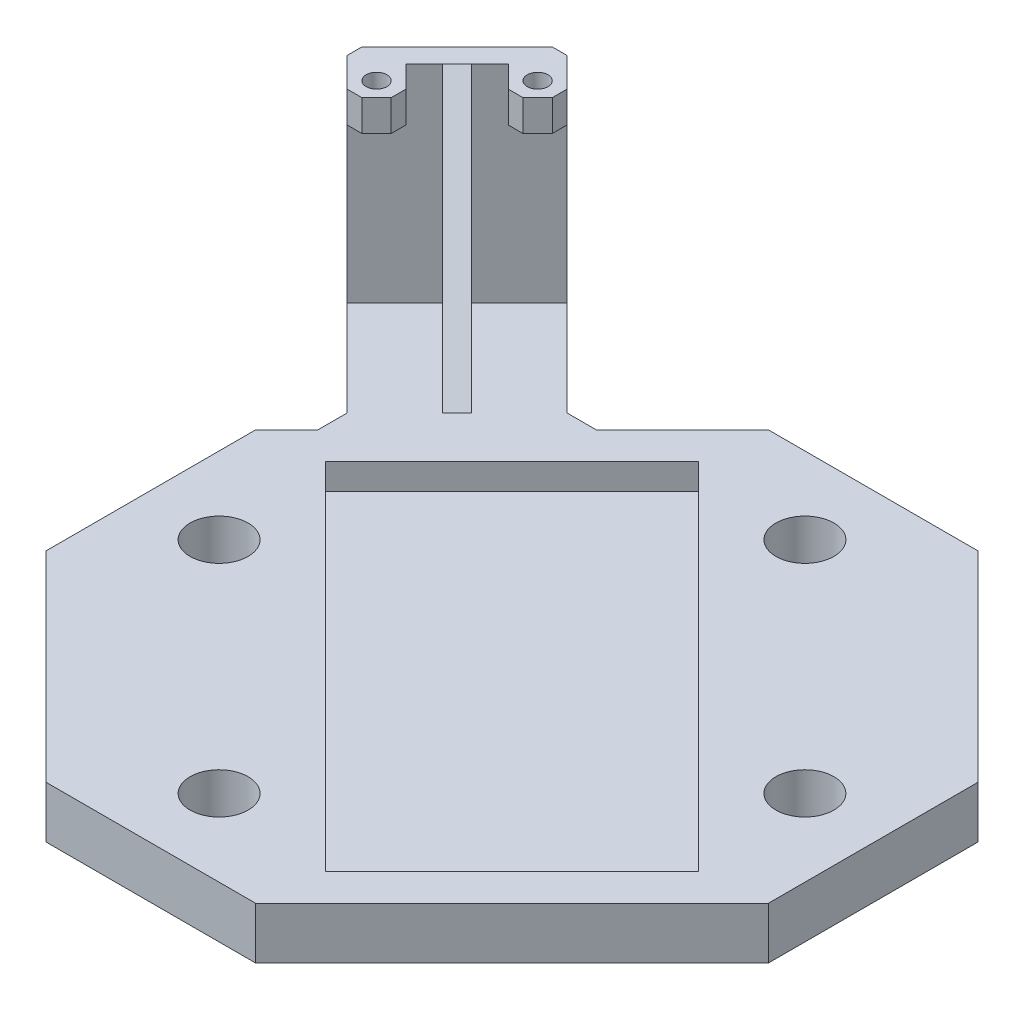
from build123d import *

# Parameters (mm, degrees)
SKETCH1_R           = 2.8
BOSS_EXTRUDE1_DEPTH = 5
CUT_EXTRUDE1_DEPTH  = 2.5
SKETCH3_W           = 35
SKETCH3_H           = 5
BOSS_EXTRUDE2_DEPTH = 17
BOSS_EXTRUDE3_DEPTH = 20
SKETCH5_W           = 4
SKETCH5_H           = 3
BOSS_EXTRUDE4_DEPTH = 4
CUT_EXTRUDE2_REACH  = 80.107
SKETCH6_R           = 1
CUT_EXTRUDE5_REACH  = 93.963
SKETCH12_W          = 6.25
SKETCH12_H          = 20
SKETCH12_W_2        = 13.75
CUT_EXTRUDE6_REACH  = 78.654
CHAMFER6_SIZE       = 2
CHAMFER7_SIZE       = 1
CHAMFER8_SIZE       = 1
RIB1_REACH          = 69.778
SKETCH17_WALL_W     = 161.408820482
SKETCH17_WALL_H     = 2


with BuildPart() as part:
    # Sketch1 → Boss-Extrude1 (new body)
    with BuildSketch(Plane(origin=(0, 0, 0), x_dir=(1, 0, 0), z_dir=(0, 1, 0))):
        Polygon((-40.303943114, 15.555205773), (-15.555205773, 40.303943114), (4.694794227, 40.303943114), (24.042773974, 20.955963368), (24.042773974, 0.705963368), (-0.705963368, -24.042773974), (-20.955963368, -24.042773974), (-40.303943114, -4.694794227), align=None)
        with Locations(Location((-11.666118476, -16.618152771, 0), (0, 0, 270))):
            Circle(SKETCH1_R, mode=Mode.SUBTRACT)
        with Locations(Location((16.618152771, 11.666118476, 0), (0, 0, 270))):
            Circle(SKETCH1_R, mode=Mode.SUBTRACT)
        with Locations(Location((-4.595050664, 32.879321912, 0), (0, 0, 270))):
            Circle(SKETCH1_R, mode=Mode.SUBTRACT)
        with Locations(Location((-32.879321912, 4.595050664, 0), (0, 0, 270))):
            Circle(SKETCH1_R, mode=Mode.SUBTRACT)
    extrude(amount=BOSS_EXTRUDE1_DEPTH)

    # Sketch2 → Cut-Extrude1 (cut)
    with BuildSketch(Plane(origin=(0, 5, 0), x_dir=(1, 0, 0), z_dir=(0, 1, 0))):
        Polygon((0.001143413, -18.032366333), (-34.293535474, 16.262312554), (-16.262312554, 34.293535474), (18.032366333, -0.001143413), align=None)
    extrude(amount=-CUT_EXTRUDE1_DEPTH, mode=Mode.SUBTRACT)

    # Sketch3 → Boss-Extrude2 (add)
    with BuildSketch(Plane(origin=(-27.929574444, 0, -27.929574444), x_dir=(-0.7071067811865489, 0, 0.7071067811865461), z_dir=(-0.7071067811865461, 0, -0.7071067811865489))):
        with Locations((0, 2.5)):
            Rectangle(SKETCH3_W, SKETCH3_H)
    extrude(amount=BOSS_EXTRUDE2_DEPTH)

    # Sketch4 → Boss-Extrude3 (add)
    with BuildSketch(Plane(origin=(0, 5, 0), x_dir=(1, 0, 0), z_dir=(0, 1, 0))):
        Polygon((-52.324758395, 27.576021053), (-50.910544832, 26.161807491), (-26.161807491, 50.910544832), (-27.576021053, 52.324758395), align=None)
    extrude(amount=BOSS_EXTRUDE3_DEPTH)

    # Sketch5 → Boss-Extrude4 (add)
    with BuildSketch(Plane(origin=(-38.536176161, 0, -38.536176161), x_dir=(0.7071067811865475, 0, -0.7071067811865477), z_dir=(0.7071067811865477, 0, 0.7071067811865475))):
        with Locations((-9.25, 23.5)):
            Rectangle(SKETCH5_W, SKETCH5_H)
        with Locations((1.75, 23.5)):
            Rectangle(SKETCH5_W, SKETCH5_H)
    extrude(amount=BOSS_EXTRUDE4_DEPTH)

    # Sketch6 → Cut-Extrude2 (cut, up to next)
    with BuildSketch(Plane(origin=(0, 25, 0), x_dir=(1, 0, 0), z_dir=(0, 1, 0)), mode=Mode.PRIVATE) as cut_extrude2_sk1:
        with Locations(Location((-43.662700325, 30.581224873, 0), (0, 0, 270))):
            Circle(SKETCH6_R)
    cut_extrude2_tool1 = extrude(cut_extrude2_sk1.sketch, amount=-CUT_EXTRUDE2_REACH, mode=Mode.PRIVATE) & part.part
    # Sketch6 → Cut-Extrude2 (cut, up to next)
    with BuildSketch(Plane(origin=(0, 25, 0), x_dir=(1, 0, 0), z_dir=(0, 1, 0)), mode=Mode.PRIVATE) as cut_extrude2_sk2:
        with Locations(Location((-35.884525732, 38.359399466, 0), (0, 0, 270))):
            Circle(SKETCH6_R)
    cut_extrude2_tool2 = extrude(cut_extrude2_sk2.sketch, amount=-CUT_EXTRUDE2_REACH, mode=Mode.PRIVATE) & part.part
    add(cut_extrude2_tool1.solids().sort_by_distance((-43.6627, 25, -30.581225))[0], mode=Mode.SUBTRACT)
    add(cut_extrude2_tool2.solids().sort_by_distance((-35.884526, 25, -38.359399))[0], mode=Mode.SUBTRACT)

    # Sketch12 → Cut-Extrude5 (cut, up to next)
    with BuildSketch(Plane(origin=(-38.536176161, 0, -38.536176161), x_dir=(0.7071067811865476, 0, -0.7071067811865476), z_dir=(0.7071067811865476, 0, 0.7071067811865476)), mode=Mode.PRIVATE) as cut_extrude5_sk1:
        with Locations((-14.375, 15)):
            Rectangle(SKETCH12_W, SKETCH12_H)
    cut_extrude5_tool1 = extrude(cut_extrude5_sk1.sketch, amount=-CUT_EXTRUDE5_REACH, mode=Mode.PRIVATE) & part.part
    # Sketch12 → Cut-Extrude5 (cut, up to next)
    with BuildSketch(Plane(origin=(-38.536176161, 0, -38.536176161), x_dir=(0.7071067811865476, 0, -0.7071067811865476), z_dir=(0.7071067811865476, 0, 0.7071067811865476)), mode=Mode.PRIVATE) as cut_extrude5_sk2:
        with Locations((10.625, 15)):
            Rectangle(SKETCH12_W_2, SKETCH12_H)
    cut_extrude5_tool2 = extrude(cut_extrude5_sk2.sketch, amount=-CUT_EXTRUDE5_REACH, mode=Mode.PRIVATE) & part.part
    add(cut_extrude5_tool1.solids().sort_by_distance((-48.700836, 15, -28.371516))[0], mode=Mode.SUBTRACT)
    add(cut_extrude5_tool2.solids().sort_by_distance((-31.023167, 15, -46.049186))[0], mode=Mode.SUBTRACT)

    # Sketch13 → Cut-Extrude6 (cut, up to next)
    with BuildSketch(Plane(origin=(0, 5, 0), x_dir=(1, 0, 0), z_dir=(0, 1, 0)), mode=Mode.PRIVATE) as cut_extrude6_sk1:
        Polygon((-52.324758395, 27.576021053), (-50.910544832, 26.161807491), (-46.49112745, 30.581224873), (-47.905341012, 31.995438435), align=None)
    cut_extrude6_tool1 = extrude(cut_extrude6_sk1.sketch, amount=-CUT_EXTRUDE6_REACH, mode=Mode.PRIVATE) & part.part
    # Sketch13 → Cut-Extrude6 (cut, up to next)
    with BuildSketch(Plane(origin=(0, 5, 0), x_dir=(1, 0, 0), z_dir=(0, 1, 0)), mode=Mode.PRIVATE) as cut_extrude6_sk2:
        Polygon((-46.49112745, 30.581224873), (-50.910544832, 26.161807491), (-40.303943114, 15.555205773), (-35.884525732, 19.974623155), align=None)
    cut_extrude6_tool2 = extrude(cut_extrude6_sk2.sketch, amount=-CUT_EXTRUDE6_REACH, mode=Mode.PRIVATE) & part.part
    # Sketch13 → Cut-Extrude6 (cut, up to next)
    with BuildSketch(Plane(origin=(0, 5, 0), x_dir=(1, 0, 0), z_dir=(0, 1, 0)), mode=Mode.PRIVATE) as cut_extrude6_sk3:
        Polygon((-27.576021053, 52.324758395), (-37.298739294, 42.602040153), (-35.884525732, 41.187826591), (-25.277924014, 30.581224873), (-15.555205773, 40.303943114), align=None)
    cut_extrude6_tool3 = extrude(cut_extrude6_sk3.sketch, amount=-CUT_EXTRUDE6_REACH, mode=Mode.PRIVATE) & part.part
    add(cut_extrude6_tool1.solids().sort_by_distance((-49.407943, 5, -29.078623))[0], mode=Mode.SUBTRACT)
    add(cut_extrude6_tool2.solids().sort_by_distance((-43.397535, 5, -23.068215))[0], mode=Mode.SUBTRACT)
    add(cut_extrude6_tool3.solids().sort_by_distance((-26.426973, 5, -41.452992))[0], mode=Mode.SUBTRACT)

    # Chamfer6
    chamfer6_edges = [part.edges().sort_by_distance(p)[0] for p in [
        (-25.277924014, 2.5, -30.581224873),
        (-35.884525732, 2.5, -19.974623155),
    ]]
    chamfer(chamfer6_edges, length=CHAMFER6_SIZE)

    # Chamfer7
    chamfer7_edges = [part.edges().sort_by_distance(p)[0] for p in [
        (-47.905341012, 12.5, -31.995438435),
        (-37.298739294, 12.5, -42.602040153),
    ]]
    chamfer(chamfer7_edges, length=CHAMFER7_SIZE)

    # Chamfer8
    chamfer8_edges = [part.edges().sort_by_distance(p)[0] for p in [
        (-43.662700325, 23.5, -27.752797748),
        (-40.8342732, 23.5, -30.581224873),
        (-35.884525732, 23.5, -35.530972341),
        (-33.056098607, 23.5, -38.359399466),
    ]]
    chamfer(chamfer8_edges, length=CHAMFER8_SIZE)

    # Sketch17 wall → Rib1 (add, up to next)
    with BuildSketch(Plane(origin=(-36.591632513, 15, -31.288331654), x_dir=(0.385364958397, -0.838443616299, 0.385364958355), z_dir=(0.592869166727, 0.544988350599, 0.592869166727)), mode=Mode.PRIVATE) as rib1_sk1:
        Rectangle(SKETCH17_WALL_W, SKETCH17_WALL_H)
    rib1_tool1 = extrude(rib1_sk1.sketch, amount=-RIB1_REACH, mode=Mode.PRIVATE) - part.part
    add(rib1_tool1.solids().sort_by_distance((-36.591632513, 15, -31.288331654))[0])


solid = part.part
